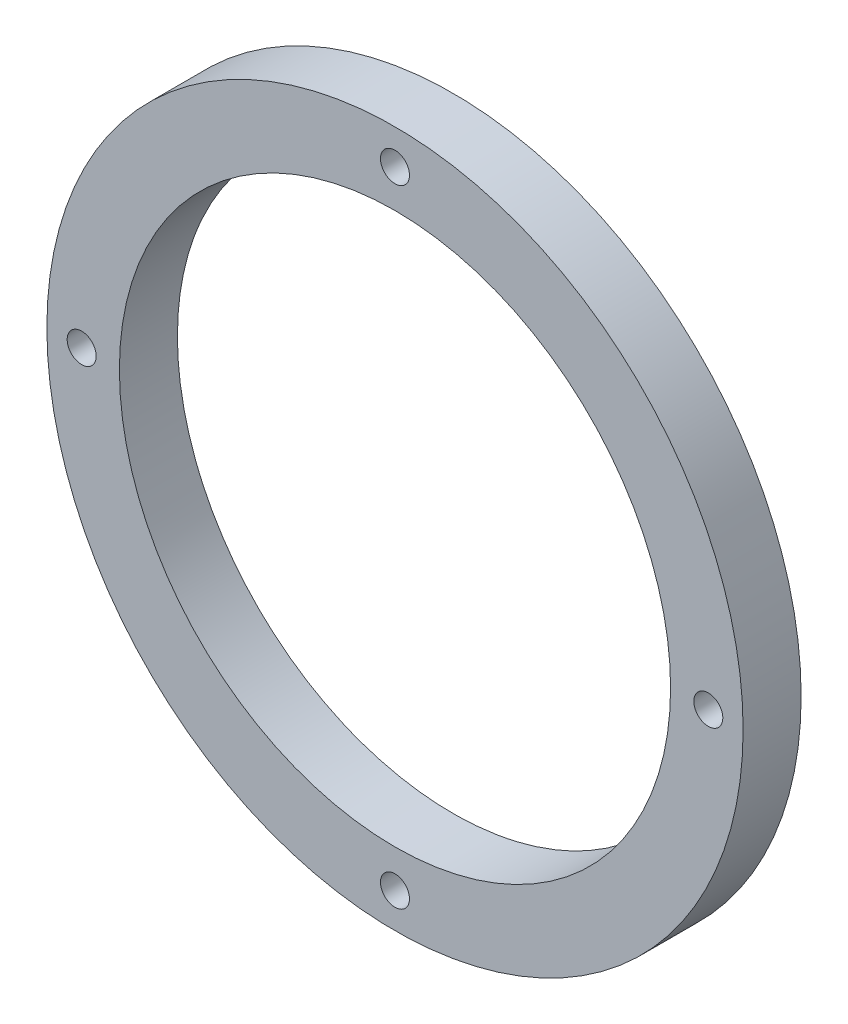
from build123d import *

# Parameters (mm, degrees)
ESKIZ_KONTUR_R        = 30
PLASTINA_DEPTH        = 5
OTVERSTIYA_DEPTH      = 43.720018727
OTVERSTIYA_DEPTH_BACK = 43.720018727
ESKIZ_OTVERSTIYA_R    = 1.25
ESKIZ_OTVERSTIYA_R_2  = 23.75


with BuildPart() as part:
    # Eskiz_kontur → Plastina (new body)
    with BuildSketch(Plane.XY):
        Circle(ESKIZ_KONTUR_R)
    extrude(amount=PLASTINA_DEPTH)

    # Eskiz_otverstiya → Otverstiya (cut, two sides: drawn at the far end of the back side and taken through both)
    with BuildSketch(Plane.XY.offset(-OTVERSTIYA_DEPTH_BACK)):
        with Locations((0, -27)):
            Circle(ESKIZ_OTVERSTIYA_R)
        with Locations((-27, 0)):
            Circle(ESKIZ_OTVERSTIYA_R)
        Circle(ESKIZ_OTVERSTIYA_R_2)
        with Locations((27, 0)):
            Circle(ESKIZ_OTVERSTIYA_R)
        with Locations((0, 27)):
            Circle(ESKIZ_OTVERSTIYA_R)
    extrude(amount=OTVERSTIYA_DEPTH + OTVERSTIYA_DEPTH_BACK, mode=Mode.SUBTRACT)


solid = part.part
